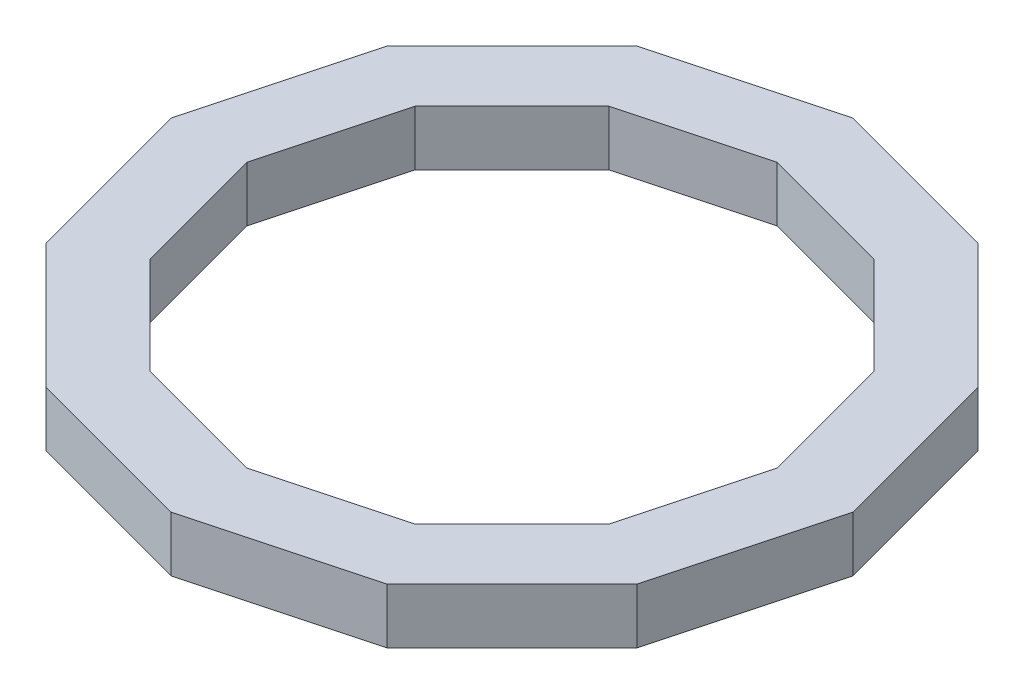
from build123d import *

# Parameters (mm, degrees)
BOSS_EXTRUDE1_DEPTH = 19.05


with BuildPart() as part:
    # Sketch1 → Boss-Extrude1 (new body)
    with BuildSketch(Plane(origin=(0, 0, 0), x_dir=(1, 0, 0), z_dir=(0, 1, 0))):
        Polygon((117.765676741, 0), (101.988067752, 58.882838371), (58.882838371, 101.988067752), (0, 117.765676741), (-58.882838371, 101.988067752), (-101.988067752, 58.882838371), (-117.765676741, 0), (-101.988067752, -58.882838371), (-58.882838371, -101.988067752), (0, -117.765676741), (58.882838371, -101.988067752), (101.988067752, -58.882838371), align=None)
        Polygon((91.469661759, 0), (79.215050759, 45.734830879), (45.734830879, 79.215050759), (0, 91.469661759), (-45.734830879, 79.215050759), (-79.215050759, 45.734830879), (-91.469661759, 0), (-79.215050759, -45.734830879), (-45.734830879, -79.215050759), (0, -91.469661759), (45.734830879, -79.215050759), (79.215050759, -45.734830879), align=None, mode=Mode.SUBTRACT)
    extrude(amount=BOSS_EXTRUDE1_DEPTH)


solid = part.part
